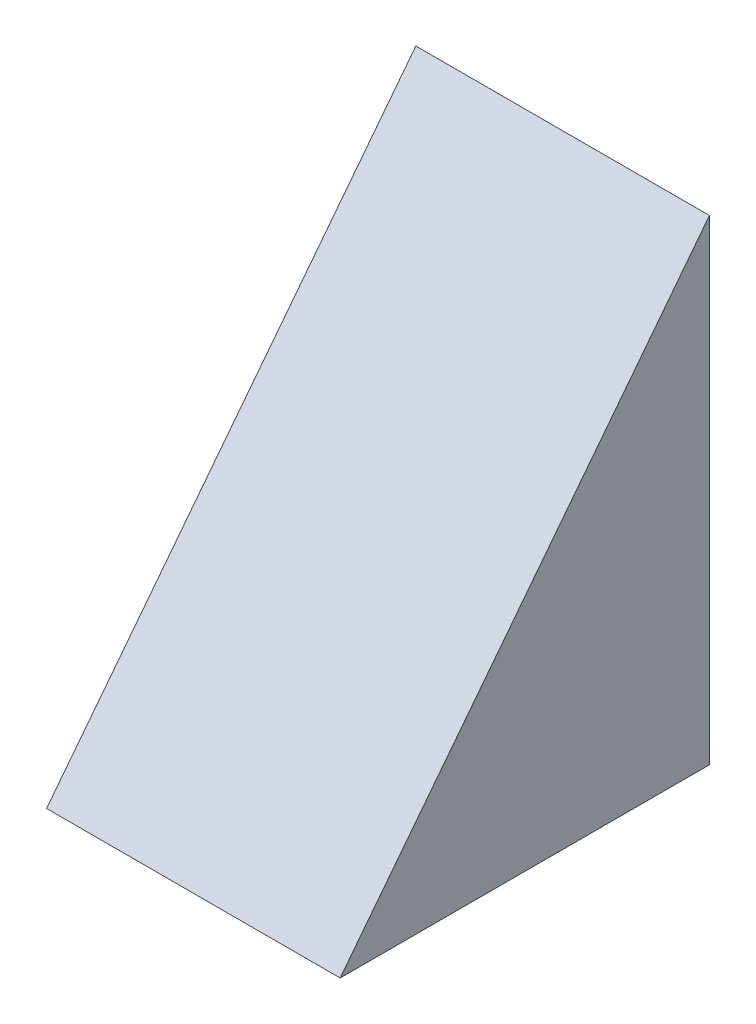
from build123d import *

# Parameters (mm, degrees)
SKETCH1_W               = 195
SKETCH1_H               = 315.976
BOSS_EXTRUDE2_DEPTH     = 257.302
CUT_EXTRUDE1_DEPTH      = 452.741244276
CUT_EXTRUDE1_DEPTH_BACK = 195


with BuildPart() as part:
    # Sketch1 → Boss-Extrude2 (new body)
    with BuildSketch(Plane.XY):
        with Locations((-97.5, 157.988)):
            Rectangle(SKETCH1_W, SKETCH1_H)
    extrude(amount=BOSS_EXTRUDE2_DEPTH)

    # Sketch3 → Cut-Extrude1 (cut, two sides: drawn at the far end of the back side and taken through both)
    with BuildSketch(Plane(origin=(0, 0, 0), x_dir=(0, 0, -1), z_dir=(1, 0, 0)).offset(-CUT_EXTRUDE1_DEPTH_BACK)):
        Polygon((505.860219824, 967.654985707), (0, 315.976), (-245.273658235, 0), (-751.13387806, -651.678985707), (-2054.491849474, 360.041453942), (-797.49775159, 1979.375425356), align=None)
    extrude(amount=CUT_EXTRUDE1_DEPTH + CUT_EXTRUDE1_DEPTH_BACK, mode=Mode.SUBTRACT)


solid = part.part
